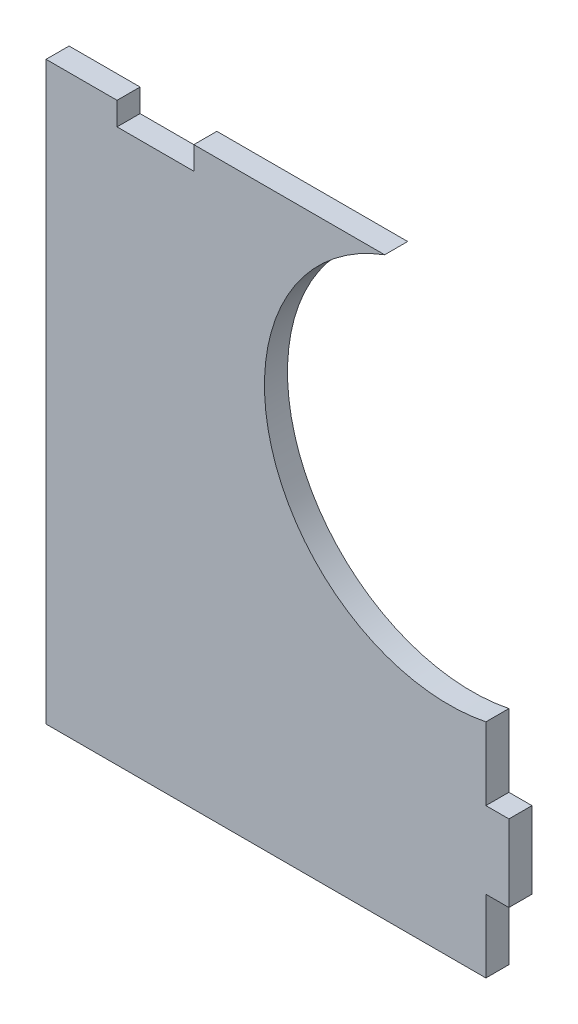
from build123d import *

# Parameters (mm, degrees)
SALIENTE_EXTRUIR1_DEPTH = 3


with BuildPart() as part:
    # Croquis1 → Saliente-Extruir1 (new body)
    with BuildSketch(Plane.XY):
        with BuildLine():
            Line((-3, 0.83840696), (-60.3, 0.83840696))
            Line((-60.3, 0.83840696), (-60.3, 75.83840696))
            Line((-60.3, 75.83840696), (-51.05, 75.83840696))
            Line((-51.05, 75.83840696), (-51.05, 72.83840696))
            Line((-51.05, 72.83840696), (-41.05, 72.83840696))
            Line((-41.05, 72.83840696), (-41.05, 75.83840696))
            Line((-41.05, 75.83840696), (-16.187910348, 75.83840696))
            ThreePointArc((-16.187910348, 75.83840696), (-30.919705343, 46.687711053), (-3, 29.73840696))
            Line((-3, 29.73840696), (-3, 20.28840696))
            Line((-3, 20.28840696), (0, 20.28840696))
            Line((0, 20.28840696), (0, 10.28840696))
            Line((0, 10.28840696), (-3, 10.28840696))
            Line((-3, 10.28840696), (-3, 0.83840696))
        make_face()
    extrude(amount=SALIENTE_EXTRUIR1_DEPTH)


solid = part.part
